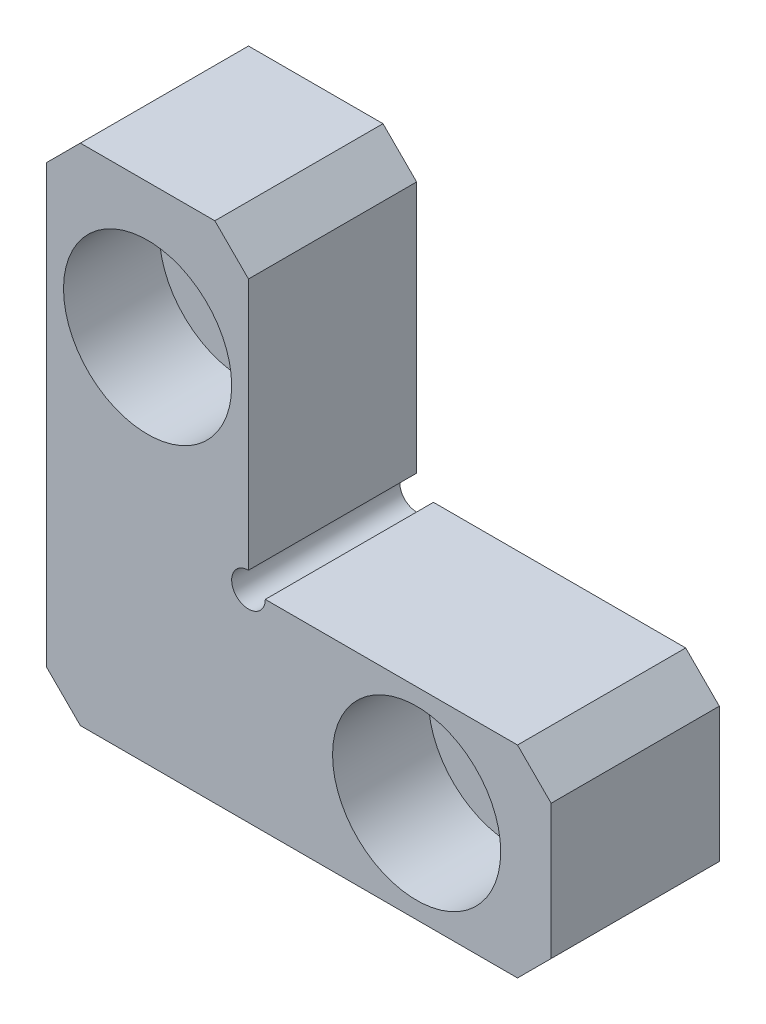
from build123d import *

# Parameters (mm, degrees)
EXTRUDE_1_DEPTH           = 5
HOLE_WIZARD_1_D           = 5.5
HOLE_WIZARD_1_CBORE_D     = 10
HOLE_WIZARD_1_CBORE_DEPTH = 5.7
CHAMFER_1_SIZE            = 2
SKETCH_5_R                = 1
CUT_EXTRUDE_1_DEPTH       = 44.588989435


with BuildPart() as part:
    # 草图1 → 凸台-拉伸1 (new, symmetric)
    with BuildSketch(Plane.XY):
        Polygon((0, 0), (0, 30), (12, 30), (12, 12), (30, 12), (30, 0), align=None)
    extrude(amount=EXTRUDE_1_DEPTH, both=True)

    # 打孔尺寸(%根据)内六角圆柱头螺钉的类型1 (through all)
    with Locations(Plane.XY.offset(5)):
        with Locations((6, 22), (22, 6)):
            CounterBoreHole(HOLE_WIZARD_1_D / 2, HOLE_WIZARD_1_CBORE_D / 2, HOLE_WIZARD_1_CBORE_DEPTH)

    # 倒角1
    chamfer_1_edges = [part.edges().sort_by_distance(p)[0] for p in [
        (0, 0, 0),
        (0, 30, 0),
        (12, 30, 0),
        (30, 12, 0),
        (30, 0, 0),
    ]]
    chamfer(chamfer_1_edges, length=CHAMFER_1_SIZE)

    # 草图5 → 切除-拉伸1 (cut, through all)
    with BuildSketch(Plane.XY.offset(5)):
        with Locations((12, 12)):
            Circle(SKETCH_5_R)
    extrude(amount=-CUT_EXTRUDE_1_DEPTH, mode=Mode.SUBTRACT)


solid = part.part
